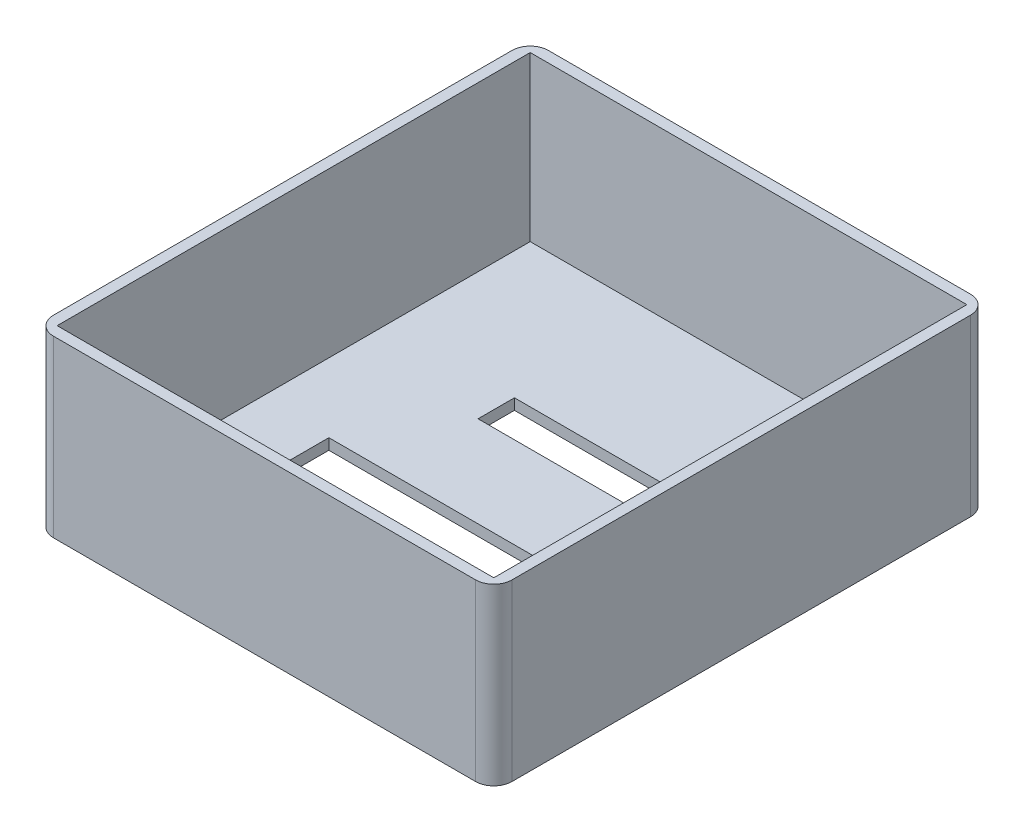
from build123d import *

# Parameters (mm, degrees)
SKETCH1_W           = 126
SKETCH1_H           = 136
BOSS_EXTRUDE1_DEPTH = 3
SKETCH2_W           = 126
SKETCH2_H           = 136
SKETCH2_W_2         = 120
SKETCH2_H_2         = 130
BOSS_EXTRUDE2_DEPTH = 45
FILLET1_R           = 5
SKETCH4_W           = 82
SKETCH4_H           = 23
SKETCH4_W_2         = 50
SKETCH4_H_2         = 10
CUT_EXTRUDE1_DEPTH  = 10


with BuildPart() as part:
    # Sketch1 → Boss-Extrude1 (new body)
    with BuildSketch(Plane(origin=(0, 0, 0), x_dir=(1, 0, 0), z_dir=(0, 1, 0))):
        Rectangle(SKETCH1_W, SKETCH1_H)
    extrude(amount=BOSS_EXTRUDE1_DEPTH)

    # Sketch2 → Boss-Extrude2 (add)
    with BuildSketch(Plane(origin=(0, 3, 0), x_dir=(1, 0, 0), z_dir=(0, 1, 0))):
        Rectangle(SKETCH2_W, SKETCH2_H)
        Rectangle(SKETCH2_W_2, SKETCH2_H_2, mode=Mode.SUBTRACT)
    extrude(amount=BOSS_EXTRUDE2_DEPTH)

    # Fillet1
    fillet1_edges = [part.edges().sort_by_distance(p)[0] for p in [
        (63, 24, 68),
        (-63, 24, 68),
        (-63, 24, -68),
        (63, 24, -68),
    ]]
    fillet(fillet1_edges, radius=FILLET1_R)

    # Sketch4 → Cut-Extrude1 (cut)
    with BuildSketch(Plane(origin=(0, 3, 0), x_dir=(1, 0, 0), z_dir=(0, 1, 0))):
        with Locations((0, -20.828487482)):
            Rectangle(SKETCH4_W, SKETCH4_H)
        with Locations((0, 20.671512518)):
            Rectangle(SKETCH4_W_2, SKETCH4_H_2)
    extrude(amount=-CUT_EXTRUDE1_DEPTH, mode=Mode.SUBTRACT)


solid = part.part
